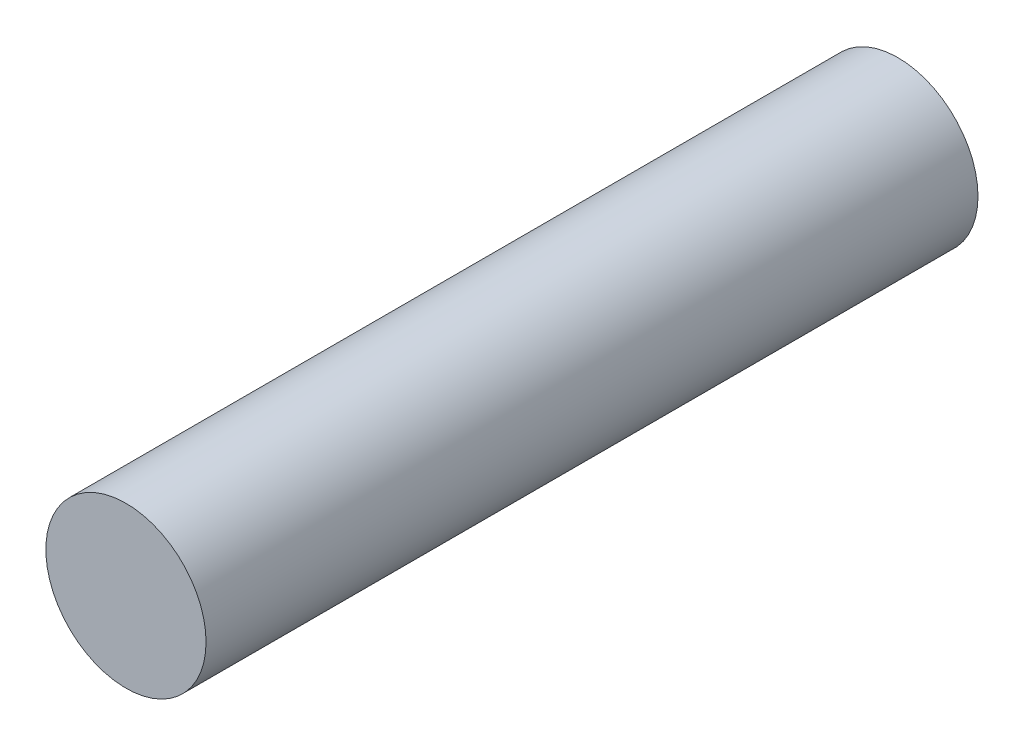
from build123d import *

# Parameters (mm, degrees)
ESQUISSE1_R        = 5.5
BOSS_EXTRU_1_DEPTH = 53


with BuildPart() as part:
    # Esquisse1 → Boss.-Extru.1 (new body)
    with BuildSketch(Plane.XY):
        Circle(ESQUISSE1_R)
    extrude(amount=BOSS_EXTRU_1_DEPTH)


solid = part.part
